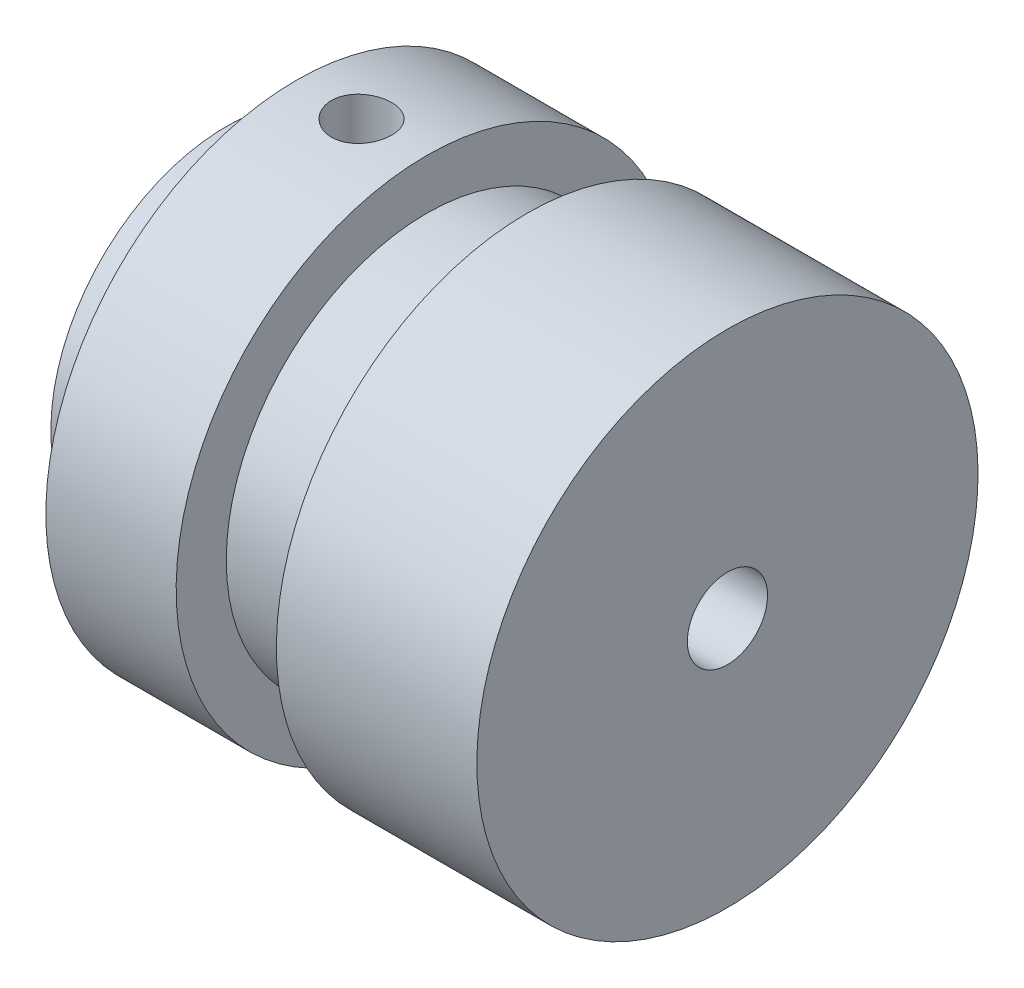
from build123d import *

# Parameters (mm, degrees)
SKETCH2_R          = 25
SKETCH2_R_2        = 17.5
CUT_EXTRUDE1_DEPTH = 7
SKETCH3_R          = 3
CUT_EXTRUDE2_DEPTH = 25


with BuildPart() as part:
    # Sketch1 → Revolve1 (revolve)
    with BuildSketch(Plane.XY):
        Polygon((0, 20), (0, 4), (25, 4), (25, 25), (5, 25), (5, 20), align=None)
    revolve(axis=Axis((25, 0, 0), (-1, 0, 0)))

    # Mirror1: part across plane


with BuildPart() as part_1:
    add(part.part)
    add(part.part.mirror(Plane(origin=(0, 0, 0), x_dir=(0, 0, 1), z_dir=(1, 0, 0))))

    # Sketch2 → Cut-Extrude1 (cut)
    with BuildSketch(Plane.ZY.offset(25)):
        with Locations(Location((0, 0, 0), (0, 0, 90))):
            Circle(SKETCH2_R)
        with Locations(Location((0, 0, 0), (0, 0, 270))):
            Circle(SKETCH2_R_2, mode=Mode.SUBTRACT)
    extrude(amount=-CUT_EXTRUDE1_DEPTH, mode=Mode.SUBTRACT)

    # Sketch3 → Cut-Extrude2 (cut)
    with BuildSketch(Plane(origin=(0, 25, 0), x_dir=(1, 0, 0), z_dir=(0, 1, 0))):
        with Locations(Location((-11.5, 0, 0), (0, 0, 180))):
            Circle(SKETCH3_R)
    extrude(amount=-CUT_EXTRUDE2_DEPTH, mode=Mode.SUBTRACT)


solid = part_1.part
